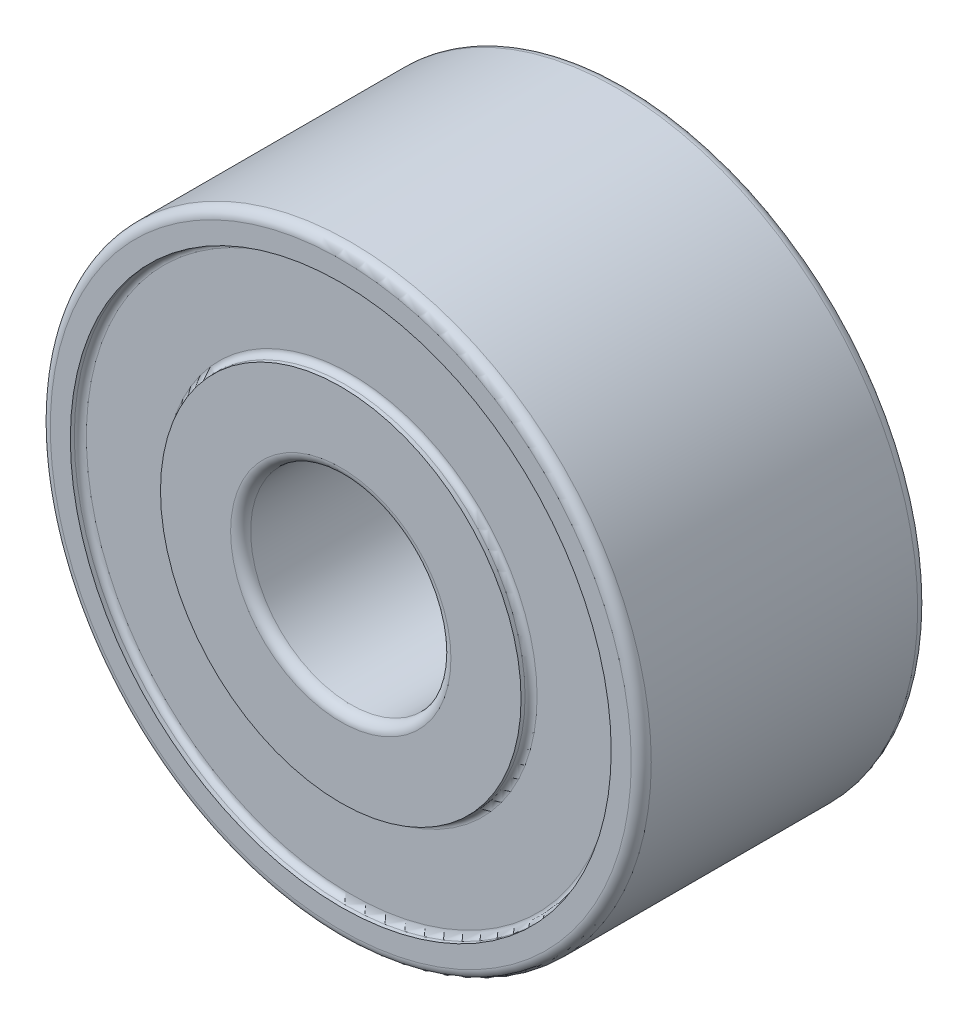
from build123d import *

# Parameters (mm, degrees)
SKIZZE1_R                       = 15
SKIZZE1_R_2                     = 5
AUFSATZ_LINEAR_AUSTRAGEN1_DEPTH = 14.3
VERRUNDUNG1_R                   = 0.5
SKIZZE2_R                       = 13.5
SKIZZE2_R_2                     = 9
SCHNITT_LINEAR_AUSTRAGEN1_DEPTH = 0.5
SCHNITT_LINEAR_START            = -0.5
SKIZZE3_R                       = 13.5
SKIZZE3_R_2                     = 9
SCHNITT_LINEAR_AUSTRAGEN2_DEPTH = 0.5
VERRUNDUNG2_R                   = 0.3


with BuildPart() as part:
    # Skizze1 → Aufsatz-Linear austragen1 (new body)
    with BuildSketch(Plane.XY):
        Circle(SKIZZE1_R)
        Circle(SKIZZE1_R_2, mode=Mode.SUBTRACT)
    extrude(amount=AUFSATZ_LINEAR_AUSTRAGEN1_DEPTH)

    # Verrundung1
    verrundung1_edges = [part.edges().sort_by_distance(p)[0] for p in [
        (-15, 0, 0),
        (-15, 0, 14.3),
        (-5, 0, 0),
        (-5, 0, 14.3),
    ]]
    fillet(verrundung1_edges, radius=VERRUNDUNG1_R)

    # Skizze2 → Schnitt-Linear austragen1 (cut)
    with BuildSketch(Plane(origin=(0, 0, 0), x_dir=(-1, 0, 0), z_dir=(0, 0, -1))):
        Circle(SKIZZE2_R)
        Circle(SKIZZE2_R_2, mode=Mode.SUBTRACT)
    extrude(amount=-SCHNITT_LINEAR_AUSTRAGEN1_DEPTH, mode=Mode.SUBTRACT)

    # Skizze3 → Schnitt-Linear austragen2 (cut)
    with BuildSketch(Plane.XY.offset(14.3).offset(SCHNITT_LINEAR_START)):
        with Locations(Location((0, 0, 0), (0, 0, 180))):
            Circle(SKIZZE3_R)
        with Locations(Location((0, 0, 0), (0, 0, 180))):
            Circle(SKIZZE3_R_2, mode=Mode.SUBTRACT)
    extrude(amount=SCHNITT_LINEAR_AUSTRAGEN2_DEPTH, mode=Mode.SUBTRACT)

    # Verrundung2
    verrundung2_edges = [part.edges().sort_by_distance(p)[0] for p in [
        (13.5, 0, 0.5),
        (9, 0, 0.5),
        (13.5, 0, 13.8),
        (9, 0, 13.8),
    ]]
    fillet(verrundung2_edges, radius=VERRUNDUNG2_R)


solid = part.part
